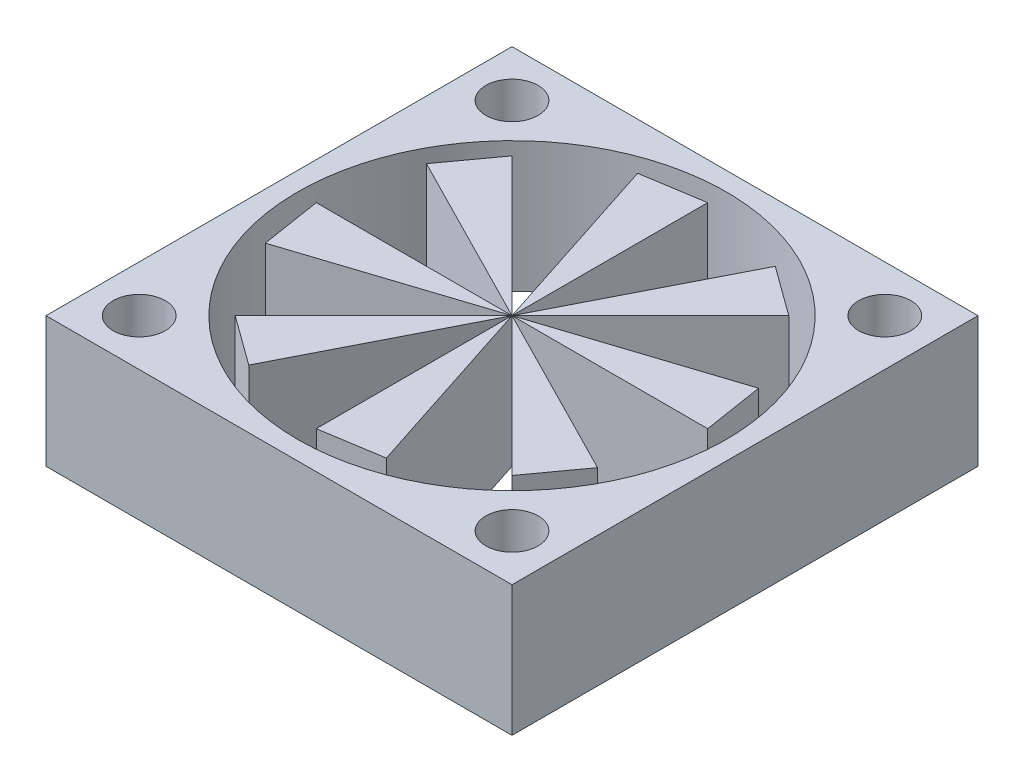
from build123d import *

# Parameters (mm, degrees)
SKETCH_1_W        = 25
SKETCH_1_H        = 25
SKETCH_1_R        = 1.4
SKETCH_1_R_2      = 11.5
EXTRUDE_1_DEPTH   = 7
EXTRUDE_2_DEPTH   = 7
EXTRUDE_2_2_DEPTH = 7
EXTRUDE_2_3_DEPTH = 7
EXTRUDE_2_4_DEPTH = 7
EXTRUDE_2_5_DEPTH = 7
EXTRUDE_2_6_DEPTH = 7
EXTRUDE_2_7_DEPTH = 7
EXTRUDE_2_8_DEPTH = 7


with BuildPart() as part:
    # 草图1 → 凸台-拉伸1 (new body)
    with BuildSketch(Plane(origin=(0, 0, 0), x_dir=(1, 0, 0), z_dir=(0, 1, 0))):
        Rectangle(SKETCH_1_W, SKETCH_1_H)
        with Locations(Location((-10, 10, 0), (0, 0, 270))):
            Circle(SKETCH_1_R, mode=Mode.SUBTRACT)
        with Locations(Location((0, 0, 0), (0, 0, 270))):
            Circle(SKETCH_1_R_2, mode=Mode.SUBTRACT)
        with Locations(Location((10, 10, 0), (0, 0, 270))):
            Circle(SKETCH_1_R, mode=Mode.SUBTRACT)
        with Locations(Location((10, -10, 0), (0, 0, 270))):
            Circle(SKETCH_1_R, mode=Mode.SUBTRACT)
        with Locations(Location((-10, -10, 0), (0, 0, 270))):
            Circle(SKETCH_1_R, mode=Mode.SUBTRACT)
    extrude(amount=EXTRUDE_1_DEPTH)


with BuildPart() as body_2:
    # 草图2 → 凸台-拉伸2 (new body)
    with BuildSketch(Plane.XZ):
        Polygon((0, 0), (7.424621202, -7.424621202), (4.766900247, -9.355568504), align=None)
    extrude(amount=-EXTRUDE_2_DEPTH)


with BuildPart() as body_3:
    # 草图2 → Extrude 2 2 (new body)
    with BuildSketch(Plane.XZ):
        Polygon((-3.244678441, -9.986093421), (0, 0), (0, -10.5), align=None)
    extrude(amount=-EXTRUDE_2_2_DEPTH)


with BuildPart() as body_4:
    # 草图2 → Extrude 2 3 (new body)
    with BuildSketch(Plane.XZ):
        Polygon((0, 0), (-7.424621202, -7.424621202), (-9.355568504, -4.766900247), align=None)
    extrude(amount=-EXTRUDE_2_3_DEPTH)


with BuildPart() as body_5:
    # 草图2 → Extrude 2 4 (new body)
    with BuildSketch(Plane.XZ):
        Polygon((0, 0), (-10.5, 0), (-9.986093421, 3.244678441), align=None)
    extrude(amount=-EXTRUDE_2_4_DEPTH)


with BuildPart() as body_6:
    # 草图2 → Extrude 2 5 (new body)
    with BuildSketch(Plane.XZ):
        Polygon((0, 0), (-7.424621202, 7.424621202), (-4.766900247, 9.355568504), align=None)
    extrude(amount=-EXTRUDE_2_5_DEPTH)


with BuildPart() as body_7:
    # 草图2 → Extrude 2 6 (new body)
    with BuildSketch(Plane.XZ):
        Polygon((0, 0), (0, 10.5), (3.244678441, 9.986093421), align=None)
    extrude(amount=-EXTRUDE_2_6_DEPTH)


with BuildPart() as body_8:
    # 草图2 → Extrude 2 7 (new body)
    with BuildSketch(Plane.XZ):
        Polygon((0, 0), (7.424621202, 7.424621202), (9.355568504, 4.766900247), align=None)
    extrude(amount=-EXTRUDE_2_7_DEPTH)


with BuildPart() as body_9:
    # 草图2 → Extrude 2 8 (new body)
    with BuildSketch(Plane.XZ):
        Polygon((0, 0), (10.5, 0), (9.986093421, -3.244678441), align=None)
    extrude(amount=-EXTRUDE_2_8_DEPTH)


solid = Compound([part.part, body_2.part, body_3.part, body_4.part, body_5.part, body_6.part, body_7.part, body_8.part, body_9.part])
